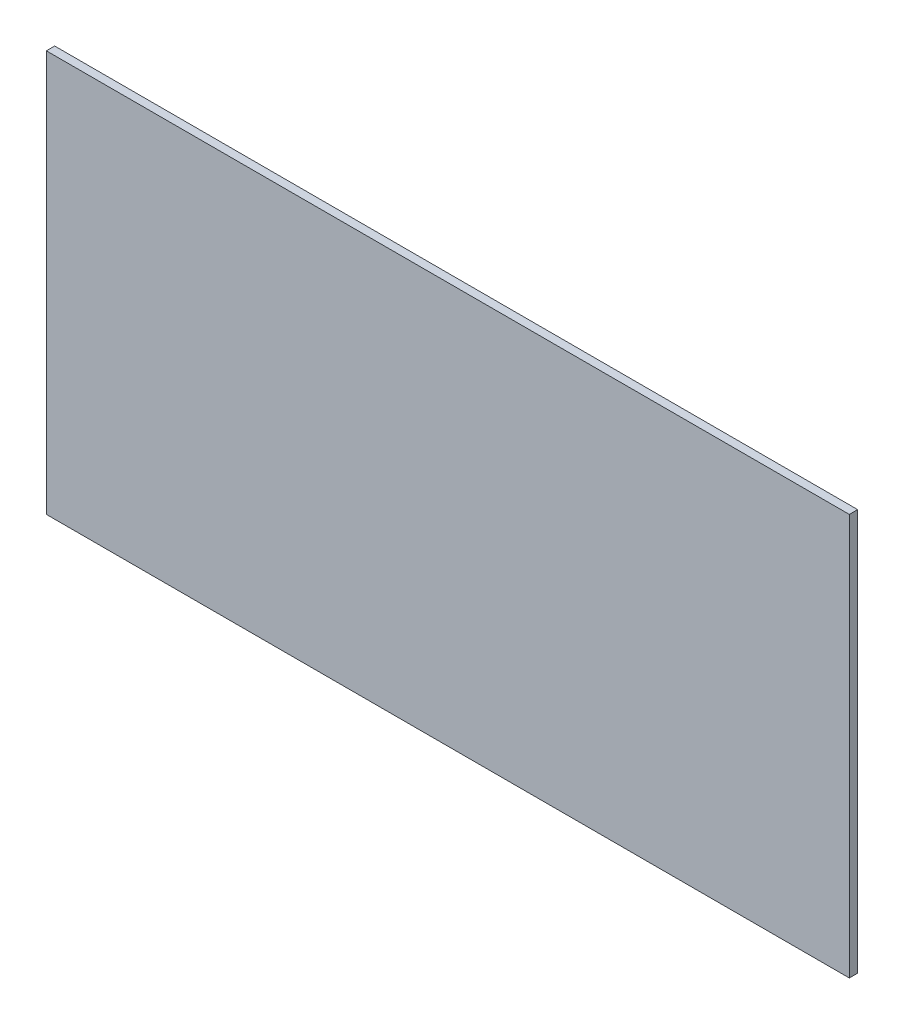
from build123d import *

# Parameters (mm, degrees)
SKETCH1_W           = 608
SKETCH1_H           = 304
BOSS_EXTRUDE1_DEPTH = 6.3


with BuildPart() as part:
    # Sketch1 → Boss-Extrude1 (new body)
    with BuildSketch(Plane.XY):
        Rectangle(SKETCH1_W, SKETCH1_H)
    extrude(amount=BOSS_EXTRUDE1_DEPTH)


solid = part.part
